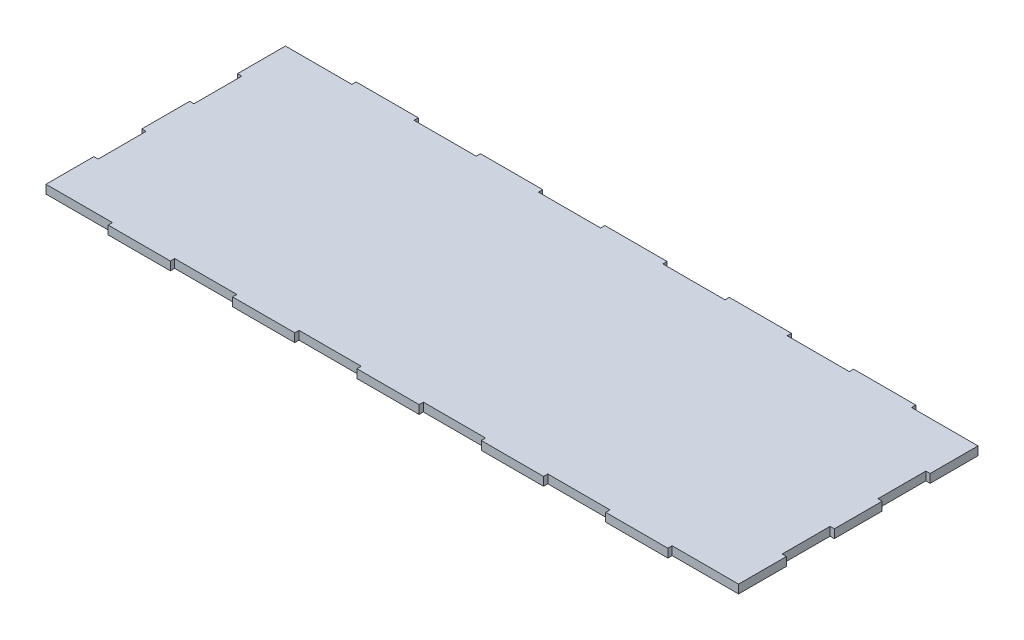
from build123d import *

# Parameters (mm, degrees)
SKETCH1_W           = 508
SKETCH1_H           = 177.8
SKETCH1_W_2         = 46.181818182
SKETCH1_H_2         = 3.175
SKETCH1_W_3         = 3.175
SKETCH1_H_3         = 35.56
BOSS_EXTRUDE1_DEPTH = 6.35


with BuildPart() as part:
    # Sketch1 → Boss-Extrude1 (new body)
    with BuildSketch(Plane(origin=(0, 0, 0), x_dir=(1, 0, 0), z_dir=(0, 1, 0))):
        with Locations((254, 88.9)):
            Rectangle(SKETCH1_W, SKETCH1_H)
        with Locations((438.727272727, 179.3875)):
            Rectangle(SKETCH1_W_2, SKETCH1_H_2)
        with Locations((346.363636364, 179.3875)):
            Rectangle(SKETCH1_W_2, SKETCH1_H_2)
        with Locations((254, 179.3875)):
            Rectangle(SKETCH1_W_2, SKETCH1_H_2)
        with Locations((161.636363636, 179.3875)):
            Rectangle(SKETCH1_W_2, SKETCH1_H_2)
        with Locations((69.272727273, 179.3875)):
            Rectangle(SKETCH1_W_2, SKETCH1_H_2)
        with Locations((-1.5875, 160.02)):
            Rectangle(SKETCH1_W_3, SKETCH1_H_3)
        with Locations((-1.5875, 88.9)):
            Rectangle(SKETCH1_W_3, SKETCH1_H_3)
        with Locations((-1.5875, 17.78)):
            Rectangle(SKETCH1_W_3, SKETCH1_H_3)
        with Locations((346.363636364, -1.5875)):
            Rectangle(SKETCH1_W_2, SKETCH1_H_2)
        with Locations((438.727272727, -1.5875)):
            Rectangle(SKETCH1_W_2, SKETCH1_H_2)
        with Locations((509.5875, 17.78)):
            Rectangle(SKETCH1_W_3, SKETCH1_H_3)
        with Locations((509.5875, 88.9)):
            Rectangle(SKETCH1_W_3, SKETCH1_H_3)
        with Locations((509.5875, 160.02)):
            Rectangle(SKETCH1_W_3, SKETCH1_H_3)
        with Locations((69.272727273, -1.5875)):
            Rectangle(SKETCH1_W_2, SKETCH1_H_2)
        with Locations((161.636363636, -1.5875)):
            Rectangle(SKETCH1_W_2, SKETCH1_H_2)
        with Locations((254, -1.5875)):
            Rectangle(SKETCH1_W_2, SKETCH1_H_2)
    extrude(amount=BOSS_EXTRUDE1_DEPTH)


solid = part.part
